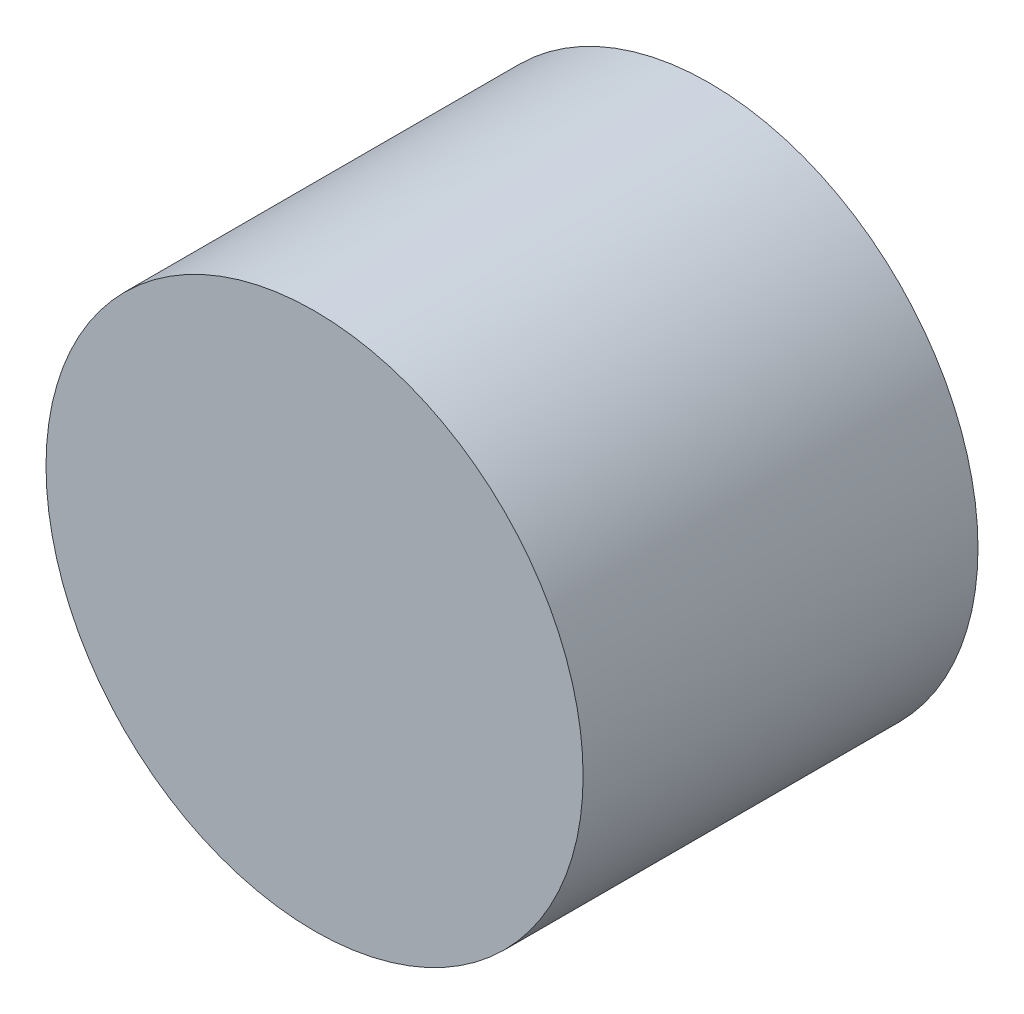
from build123d import *

# Parameters (mm, degrees)
SKETCH1_R           = 11.147
BOSS_EXTRUDE1_DEPTH = 16.391


with BuildPart() as part:
    # Sketch1 → Boss-Extrude1 (new body)
    with BuildSketch(Plane.XY):
        with Locations((6.787, -3.953)):
            Circle(SKETCH1_R)
    extrude(amount=BOSS_EXTRUDE1_DEPTH)


solid = part.part
